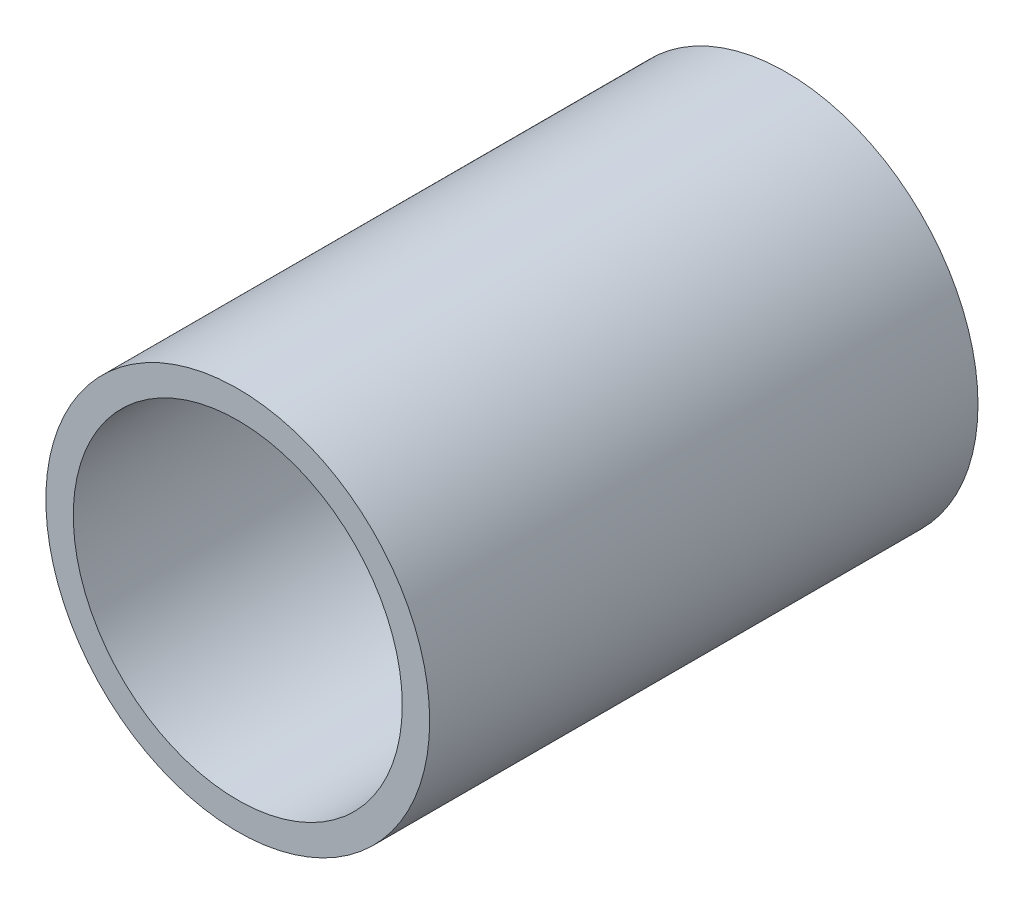
from build123d import *

# Parameters (mm, degrees)
SKETCH1_R           = 8.89
BOSS_EXTRUDE1_DEPTH = 25.4
SKETCH2_R           = 7.62
CUT_EXTRUDE1_DEPTH  = 35.306


with BuildPart() as part:
    # Sketch1 → Boss-Extrude1 (new body)
    with BuildSketch(Plane.XY):
        Circle(SKETCH1_R)
    extrude(amount=BOSS_EXTRUDE1_DEPTH)

    # Sketch2 → Cut-Extrude1 (cut)
    with BuildSketch(Plane.XY.offset(25.4)):
        Circle(SKETCH2_R)
    extrude(amount=-CUT_EXTRUDE1_DEPTH, mode=Mode.SUBTRACT)


solid = part.part
